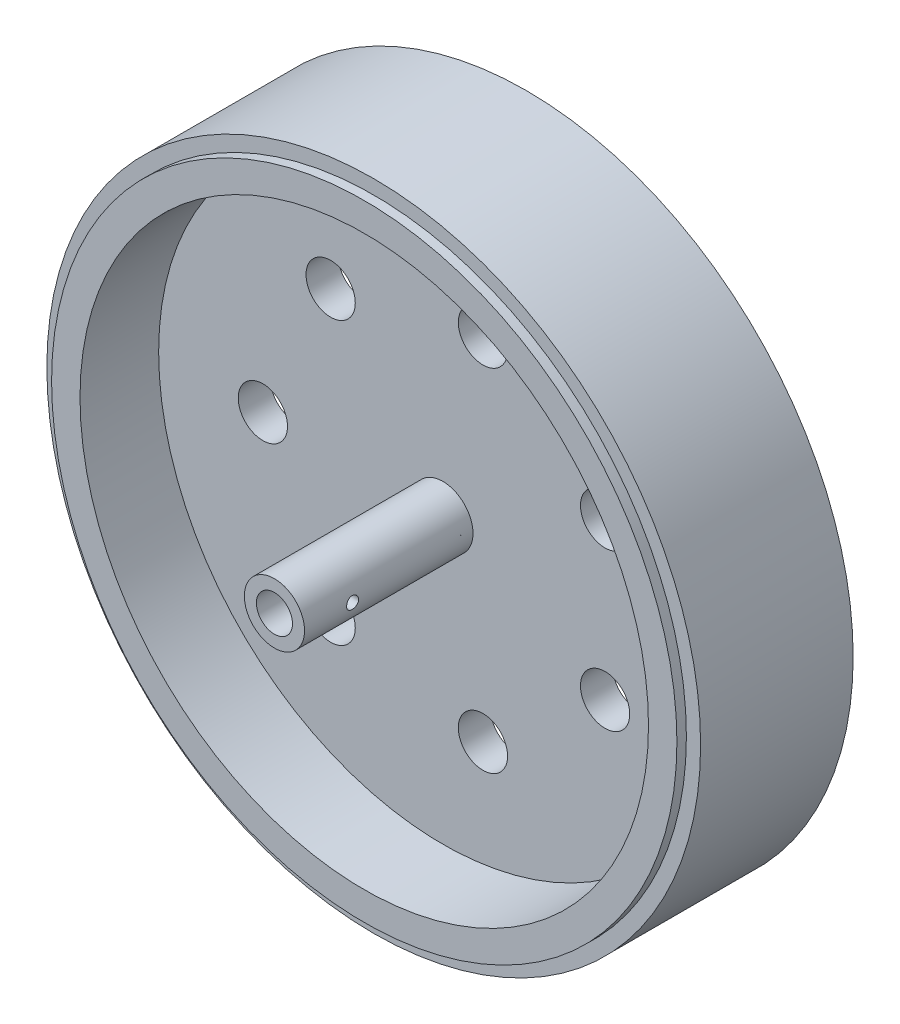
from build123d import *

# Parameters (mm, degrees)
SKETCH1_R               = 30
EXTRUDE1_DEPTH          = 3.4
SKETCH2_R               = 33.4
SKETCH2_R_2             = 30
EXTRUDE2_DEPTH          = 8.3
EXTRUDE3_START          = 9.8
SKETCH3_R               = 33.4
SKETCH3_R_2             = 30
EXTRUDE3_DEPTH          = 9.8
EXTRUDE4_START          = -18.1
SKETCH4_R               = 34.5
SKETCH4_R_2             = 33.4
EXTRUDE4_DEPTH          = 18.1
SKETCH6_R               = 34.5
SKETCH6_R_2             = 33
EXTRUDE5_DEPTH          = 1
EXTRUDE6_START          = -1
SKETCH8_R               = 34.5
SKETCH8_R_2             = 33
EXTRUDE6_DEPTH          = 1
SKETCH9_R               = 3.175
EXTRUDE7_DEPTH          = 5.08
EXTRUDE8_START          = 17.78
SKETCH10_R              = 3.175
SKETCH10_R_2            = 1.905
EXTRUDE8_DEPTH          = 17.78
SKETCH13_R              = 2.6
EXTRUDE11_DEPTH         = 10
CIRPATTERN1_COUNT       = 7
CUT_EXTRUDE1_REACH      = 55.189
CUT_EXTRUDE1_END_RADIUS = 3.175
SKETCH14_R              = 0.635
CUT_EXTRUDE2_REACH      = 57.408
SKETCH15_R              = 1.905


with BuildPart() as part:
    # Sketch1 → Extrude1 (new body)
    with BuildSketch(Plane.XY):
        Circle(SKETCH1_R)
    extrude(amount=EXTRUDE1_DEPTH)



with BuildPart() as body_2:
    # Sketch2 → Extrude2 (new body)
    with BuildSketch(Plane.XY.offset(3.4)):
        with Locations(Location((0, 0, 0), (0, 0, 180))):
            Circle(SKETCH2_R)
        Circle(SKETCH2_R_2, mode=Mode.SUBTRACT)
    extrude(amount=EXTRUDE2_DEPTH)


with BuildPart() as part_1:
    add(part.part)

    add(body_2.part)  # Extrude3 merges body 2
    # Sketch3 → Extrude3 (add)
    with BuildSketch(Plane(origin=(0, 0, 3.4), x_dir=(-1, 0, 0), z_dir=(0, 0, -1)).offset(EXTRUDE3_START)):
        with Locations(Location((0, 0, 0), (0, 0, 180))):
            Circle(SKETCH3_R)
        with Locations(Location((0, 0, 0), (0, 0, 180))):
            Circle(SKETCH3_R_2, mode=Mode.SUBTRACT)
    extrude(amount=-EXTRUDE3_DEPTH)

    # Sketch4 → Extrude4 (add)
    with BuildSketch(Plane.XY.offset(11.7).offset(EXTRUDE4_START)):
        Circle(SKETCH4_R)
        Circle(SKETCH4_R_2, mode=Mode.SUBTRACT)
    extrude(amount=EXTRUDE4_DEPTH)

    # Sketch6 → Extrude5 (cut)
    with BuildSketch(Plane(origin=(0, 0, -6.4), x_dir=(-1, 0, 0), z_dir=(0, 0, -1))):
        with Locations(Location((0, 0, 0), (0, 0, 180))):
            Circle(SKETCH6_R)
        Circle(SKETCH6_R_2, mode=Mode.SUBTRACT)
    extrude(amount=-EXTRUDE5_DEPTH, mode=Mode.SUBTRACT)

    # Sketch8 → Extrude6 (cut)
    with BuildSketch(Plane.XY.offset(11.7).offset(EXTRUDE6_START)):
        Circle(SKETCH8_R)
        with Locations(Location((0, 0, 0), (0, 0, 180))):
            Circle(SKETCH8_R_2, mode=Mode.SUBTRACT)
    extrude(amount=EXTRUDE6_DEPTH, mode=Mode.SUBTRACT)

    # Sketch9 → Extrude7 (add)
    with BuildSketch(Plane(origin=(0, 0, 0), x_dir=(-1, 0, 0), z_dir=(0, 0, -1))):
        with Locations(Location((0, 0, 0), (0, 0, 180))):
            Circle(SKETCH9_R)
    extrude(amount=EXTRUDE7_DEPTH)

    # Sketch10 → Extrude8 (add)
    with BuildSketch(Plane.XY.offset(3.4).offset(EXTRUDE8_START)):
        Circle(SKETCH10_R)
        with Locations(Location((0, 0, 0), (0, 0, 180))):
            Circle(SKETCH10_R_2, mode=Mode.SUBTRACT)
    extrude(amount=-EXTRUDE8_DEPTH)

    # Sketch13 → Extrude11 (cut, symmetric)
    with BuildSketch(Plane.XY.offset(3.4)):
        with Locations((-19, 0)):
            Circle(SKETCH13_R)
    extrude11 = extrude(amount=EXTRUDE11_DEPTH, both=True, mode=Mode.SUBTRACT)

    # CirPattern1: Extrude11 ×7 about axis
    cirpattern1_axis = Axis((0, 0, 0), (0, 0, 1))
    for i in range(1, CIRPATTERN1_COUNT):
        add(extrude11.rotate(cirpattern1_axis, i * 360 / CIRPATTERN1_COUNT), mode=Mode.SUBTRACT)

    # Cut-Extrude1: up to this cylinder (the profile starts inside it)
    cut_extrude1_end = Plane(origin=(0, 0, 16.1), z_dir=(0, 0, -1)) * Cylinder(CUT_EXTRUDE1_END_RADIUS, 117.728, mode=Mode.PRIVATE)
    # Sketch14 → Cut-Extrude1 (cut, up to the surface)
    with BuildSketch(Plane(origin=(0, 0, 0), x_dir=(0, 0, -1), z_dir=(1, 0, 0)), mode=Mode.PRIVATE) as cut_extrude1_sk1:
        with Locations(Location((-16.1, 0, 0), (0, 0, 180))):
            Circle(SKETCH14_R)
    cut_extrude1_tool1 = extrude(cut_extrude1_sk1.sketch, amount=CUT_EXTRUDE1_REACH, mode=Mode.PRIVATE) & cut_extrude1_end
    add(cut_extrude1_tool1.solids().sort_by_distance((0, 0, 16.1))[0], mode=Mode.SUBTRACT)

    # Sketch15 → Cut-Extrude2 (cut, up to next)
    with BuildSketch(Plane(origin=(0, 0, -5.08), x_dir=(-1, 0, 0), z_dir=(0, 0, -1)), mode=Mode.PRIVATE) as cut_extrude2_sk1:
        Circle(SKETCH15_R)
    cut_extrude2_tool1 = extrude(cut_extrude2_sk1.sketch, amount=-CUT_EXTRUDE2_REACH, mode=Mode.PRIVATE) & part_1.part
    add(cut_extrude2_tool1.solids().sort_by_distance((0, 0, -5.08))[0], mode=Mode.SUBTRACT)


solid = part_1.part
